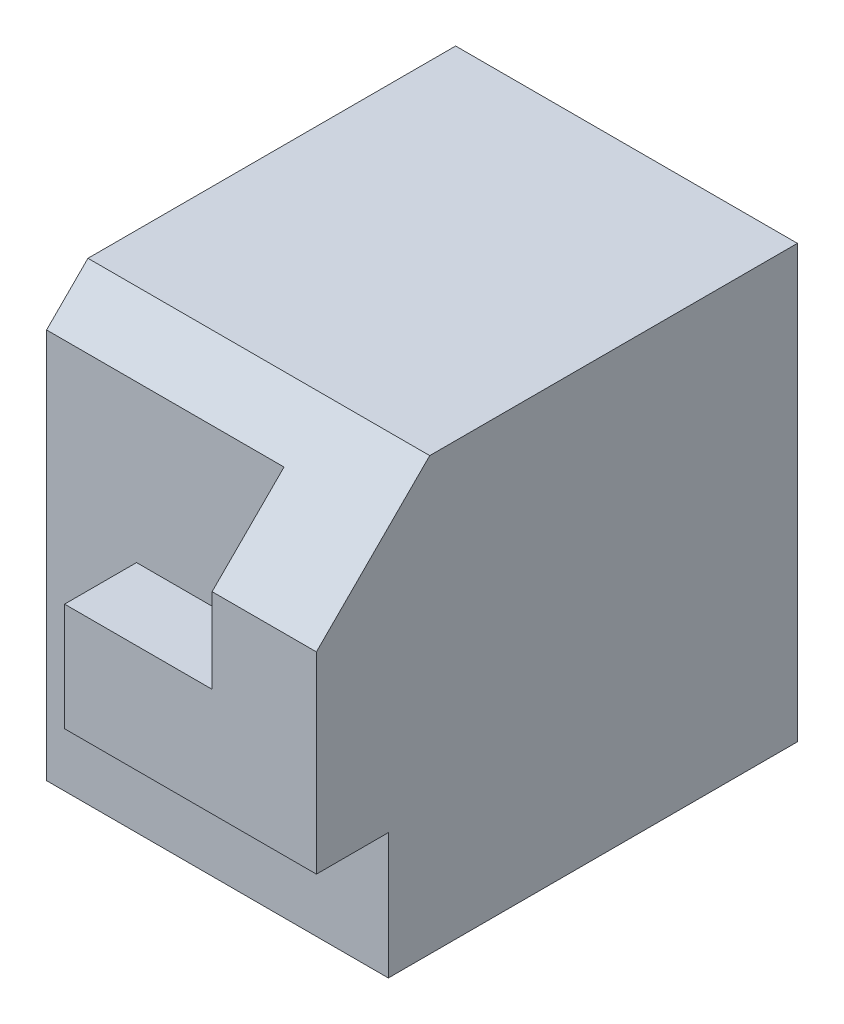
from build123d import *

# Parameters (mm, degrees)
SKETCH_1_W          = 1900
SKETCH_1_H          = 2400
EXTRUDE_1_DEPTH     = 2674
CUT_EXTRUDE_1_DEPTH = 4053.790702473
CUT_EXTRUDE_2_DEPTH = 400


with BuildPart() as part:
    # ｽｹｯﾁ1 → ﾎﾞｽ - 押し出し1 (new body)
    with BuildSketch(Plane.XY):
        with Locations((912.626610361, 1180.091695304)):
            Rectangle(SKETCH_1_W, SKETCH_1_H)
    extrude(amount=EXTRUDE_1_DEPTH)

    # ｽｹｯﾁ2 → ｶｯﾄ - 押し出し1 (cut, through all)
    with BuildSketch(Plane(origin=(1862.626610361, 0, 0), x_dir=(0, 0, -1), z_dir=(1, 0, 0))):
        Polygon((-2674, 2380.091695304), (-2674, 1750.091695304), (-2044, 2380.091695304), align=None)
    extrude(amount=-CUT_EXTRUDE_1_DEPTH, mode=Mode.SUBTRACT)

    # ｽｹｯﾁ3 → ｶｯﾄ - 押し出し2 (cut)
    with BuildSketch(Plane.XY.offset(2674)):
        Polygon((462.626610361, 1280.091695304), (1282.626610361, 1280.091695304), (1282.626610361, 2380.091695304), (-37.373389639, 2380.091695304), (-37.373389639, -19.908304696), (462.626610361, -19.908304696), (1862.626610361, -19.908304696), (1862.626610361, 680.091695304), (462.626610361, 680.091695304), align=None)
    extrude(amount=-CUT_EXTRUDE_2_DEPTH, mode=Mode.SUBTRACT)


solid = part.part
